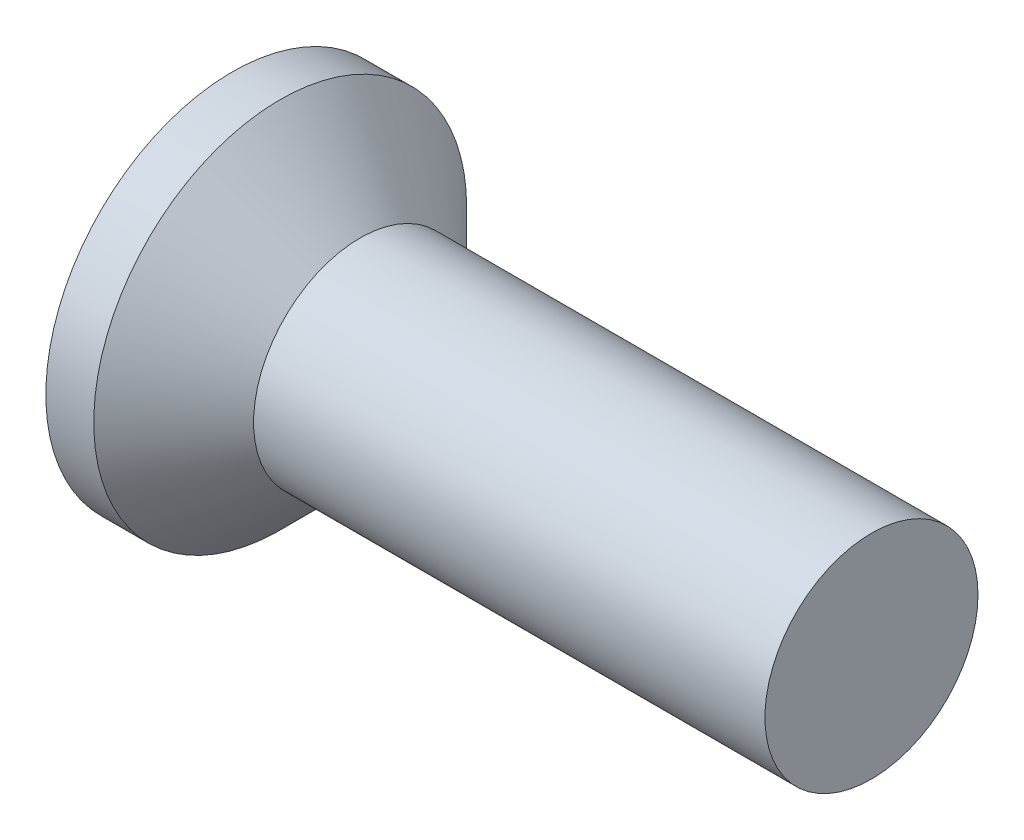
from build123d import *

# Parameters (mm, degrees)
CROSSRECESS_DEPTH = 0.6
DRAFT9_ANGLE      = 30
FILLET5_R         = 0.3


with BuildPart() as part:
    # Sketch1 → Base (revolve)
    with BuildSketch(Plane.XY, mode=Mode.PRIVATE) as base_sk:
        Polygon((6, 1), (2, 1), (1.2, 1), (0.45, 1.75), (0, 1.75), (0, 0), (6, 0), align=None)
    revolve(base_sk.sketch.rotate(Axis((4.515812911, 0, 0), (-1, 0, 0)), 90), axis=Axis((4.515812911, 0, 0), (-1, 0, 0)))

    # Sketch6 → CrossRecess (cut)
    with BuildSketch(Plane(origin=(0, 0, 0), x_dir=(0, 0, -1), z_dir=(1, 0, 0))):
        Polygon((0.19, 0.19), (0.19, 0.95), (-0.19, 0.95), (-0.19, 0.19), (-0.95, 0.19), (-0.95, -0.19), (-0.19, -0.19), (-0.19, -0.95), (0.19, -0.95), (0.19, -0.19), (0.95, -0.19), (0.95, 0.19), align=None)
    extrude(amount=CROSSRECESS_DEPTH, mode=Mode.SUBTRACT)

    # Draft9
    draft9_faces = [part.faces().sort_by_distance(p)[0] for p in [
        (0.3, 0.95, 0),
        (0.3, 0, 0.95),
        (0.3, -0.95, 0),
        (0.3, 0, -0.95),
    ]]
    draft(draft9_faces, Plane(origin=(0, 1.75, 0), x_dir=(0, 0, -1), z_dir=(-1, 0, 0)), DRAFT9_ANGLE)

    # Fillet5
    fillet5_edges = [part.edges().sort_by_distance(p)[0] for p in [
        (0.3, 0.19, 0.19),
        (0.3, -0.19, 0.19),
        (0.3, -0.19, -0.19),
        (0.3, 0.19, -0.19),
    ]]
    fillet(fillet5_edges, radius=FILLET5_R)


solid = part.part
